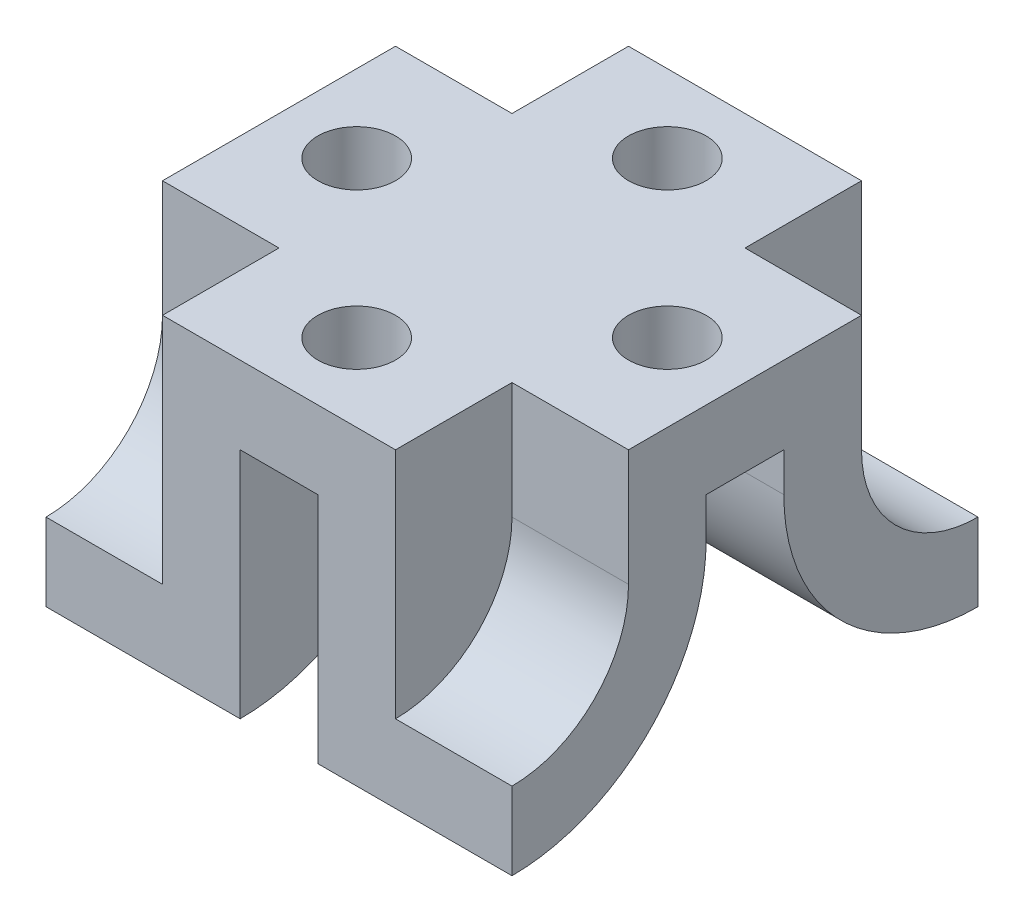
from build123d import *
from build123d.topology import SkipClean

# Parameters (mm, degrees)
EXTRUDE_1_DEPTH     = 12
CUT_EXTRUDE_5_DEPTH = 24
EXTRUDE_5_DEPTH     = 24
SKETCH_2_4_W        = 4
SKETCH_2_4_H        = 12
CUT_EXTRUDE_6_DEPTH = 12
SKETCH_9_R          = 2
CUT_EXTRUDE_7_DEPTH = 4


with BuildPart() as part:
    # 草图2 → 凸台-拉伸1 (new, symmetric)
    with BuildSketch(Plane.XY):
        Polygon((2, 12), (2, 0), (12, 0), (12, 4), (6, 4), (6, 16), (-6, 16), (-6, 4), (-12, 4), (-12, 0), (-2, 0), (-2, 12), align=None)
    extrude(amount=EXTRUDE_1_DEPTH, both=True)

    # 草图7 → 切除-拉伸5 (cut)
    with BuildSketch(Plane(origin=(12, 0, 0), x_dir=(0, 0, -1), z_dir=(1, 0, 0))):
        with BuildLine():
            Line((-2, 12), (-2, 10))
            ThreePointArc((-2, 10), (-4.928932188, 2.928932188), (-12, 0))
            Line((-12, 0), (12, 0))
            ThreePointArc((12, 0), (4.928932188, 2.928932188), (2, 10))
            Line((2, 10), (2, 12))
            Line((2, 12), (-2, 12))
        make_face()
    extrude(amount=-CUT_EXTRUDE_5_DEPTH, mode=Mode.SUBTRACT)

    # 草图7<4> → 凸台-拉伸5 (add)
    with SkipClean():  # the faces are left unmerged after this step: merging them gives an invalid solid
        with BuildSketch(Plane(origin=(12, 0, 0), x_dir=(0, 0, -1), z_dir=(1, 0, 0))):
            with BuildLine():
                ThreePointArc((-12, 0), (-4.928932188, 2.928932188), (-2, 10))
                Line((-2, 10), (-2, 12))
                Line((-2, 12), (2, 12))
                Line((2, 12), (2, 10))
                ThreePointArc((2, 10), (4.928932188, 2.928932188), (12, 0))
                Line((12, 0), (12, 4))
                ThreePointArc((12, 4), (7.757359313, 5.757359313), (6, 10))
                Line((6, 10), (6, 16))
                Line((6, 16), (-6, 16))
                Line((-6, 16), (-6, 10))
                ThreePointArc((-6, 10), (-7.757359313, 5.757359313), (-12, 4))
                Line((-12, 4), (-12, 0))
            make_face()
        extrude(amount=-EXTRUDE_5_DEPTH)
    add(part.part.scale(1), mode=Mode.REPLACE)  # the faces are merged on a copy

    # 草图2<4> → 切除-拉伸6 (cut, symmetric)
    with BuildSketch(Plane.XY):
        with Locations((0, 6)):
            Rectangle(SKETCH_2_4_W, SKETCH_2_4_H)
    extrude(amount=CUT_EXTRUDE_6_DEPTH, both=True, mode=Mode.SUBTRACT)

    # 草图9 → 切除-拉伸7 (cut)
    with BuildSketch(Plane(origin=(0, 16, 0), x_dir=(1, 0, 0), z_dir=(0, 1, 0))):
        with Locations((0, 8)):
            Circle(SKETCH_9_R)
        with Locations((-8, 0)):
            Circle(SKETCH_9_R)
        with Locations((8, 0)):
            Circle(SKETCH_9_R)
        with Locations((0, -8)):
            Circle(SKETCH_9_R)
    extrude(amount=-CUT_EXTRUDE_7_DEPTH, mode=Mode.SUBTRACT)


solid = part.part
